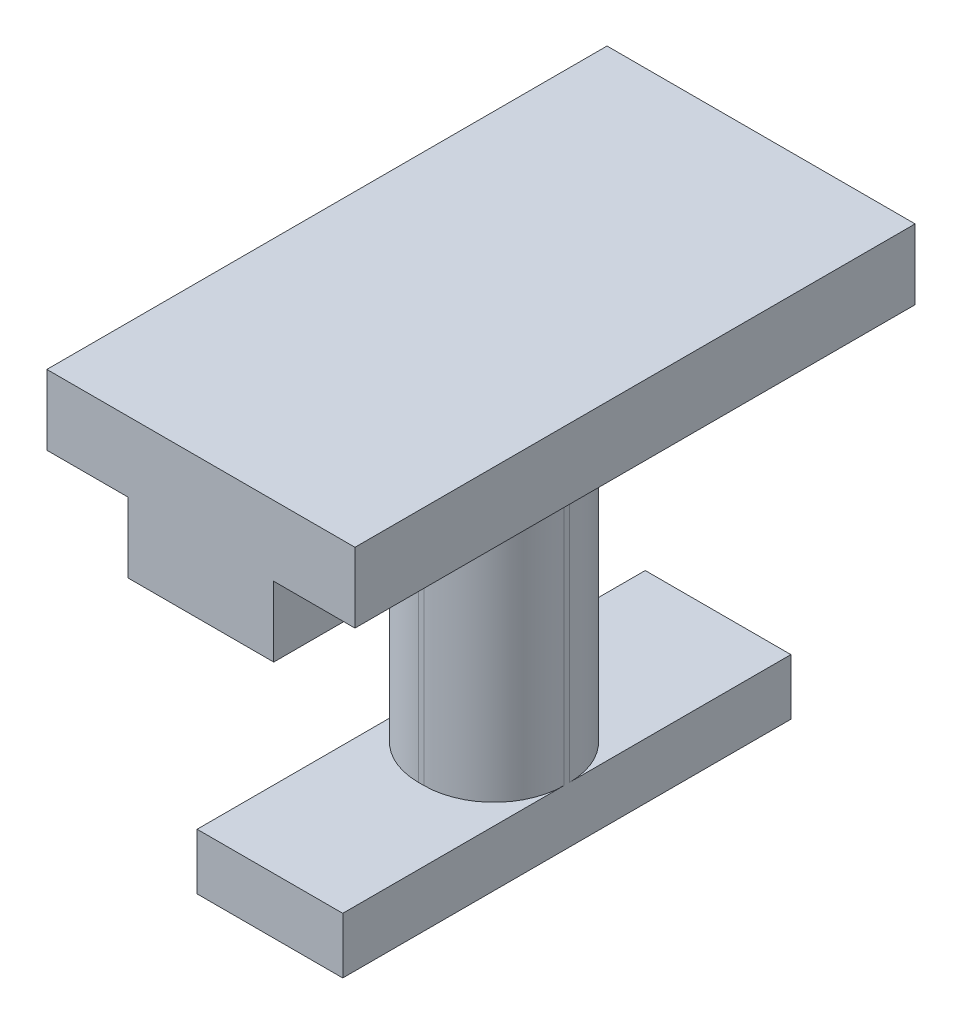
from build123d import *

# Parameters (mm, degrees)
SALIENTE_EXTRUIR1_DEPTH = 20
CROQUIS2_W              = 5.2
CROQUIS2_H              = 5.2
SALIENTE_EXTRUIR2_DEPTH = 9
CROQUIS3_W              = 5.2
CROQUIS3_H              = 16
SALIENTE_EXTRUIR4_DEPTH = 2
REDONDEO4_R             = 2.5


with BuildPart() as part:
    # Croquis1 → Saliente-Extruir1 (new body)
    with BuildSketch(Plane.XY):
        Polygon((-5.5, 0), (5.5, 0), (5.5, -2.5), (2.6, -2.5), (2.6, -5), (-2.6, -5), (-2.6, -2.5), (-5.5, -2.5), align=None)
    extrude(amount=SALIENTE_EXTRUIR1_DEPTH)

    # Croquis2 → Saliente-Extruir2 (add)
    with BuildSketch(Plane.XZ.offset(5)):
        with Locations((0, 9.535930778)):
            Rectangle(CROQUIS2_W, CROQUIS2_H)
    extrude(amount=SALIENTE_EXTRUIR2_DEPTH)

    # Croquis3 → Saliente-Extruir4 (add)
    with BuildSketch(Plane.XZ.offset(14)):
        with Locations((0, 9.535930778)):
            Rectangle(CROQUIS3_W, CROQUIS3_H)
    extrude(amount=SALIENTE_EXTRUIR4_DEPTH)

    # Redondeo4
    redondeo4_edges = [part.edges().sort_by_distance(p)[0] for p in [
        (-2.6, -9.5, 12.135930778),
        (-2.6, -9.5, 6.935930778),
        (2.6, -9.5, 6.935930778),
        (2.6, -9.5, 12.135930778),
    ]]
    fillet(redondeo4_edges, radius=REDONDEO4_R)


solid = part.part
